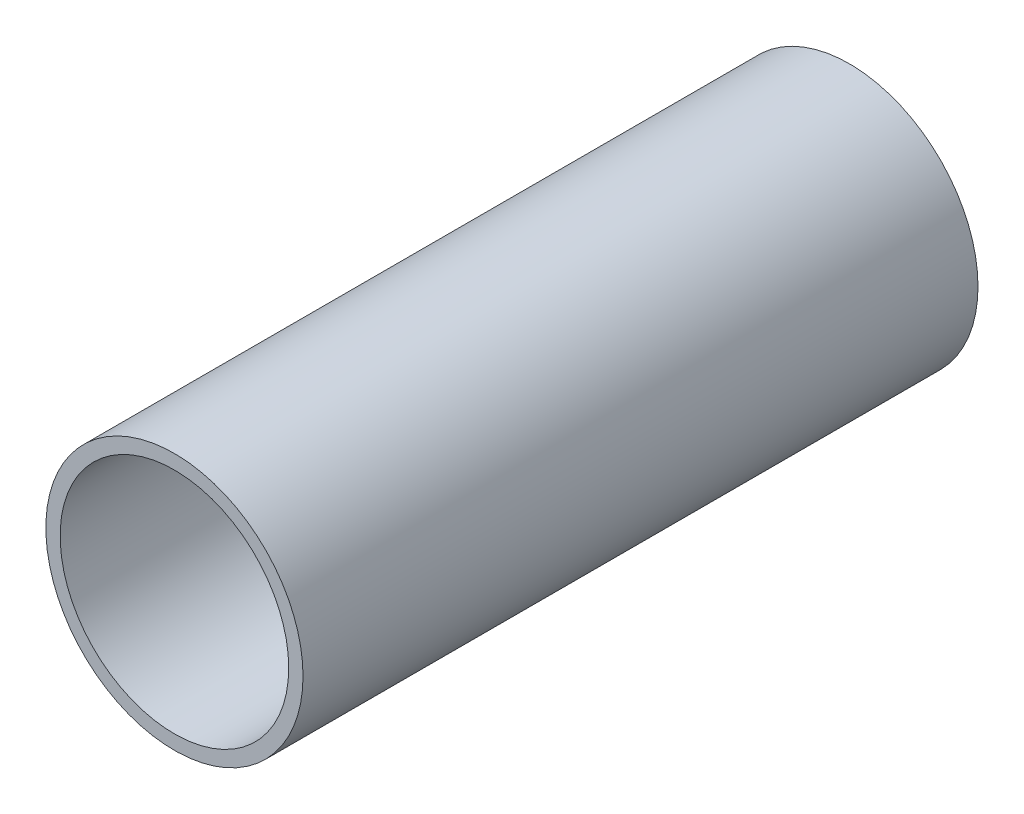
from build123d import *

# Parameters (mm, degrees)
SKETCH_1_R      = 57.15
SKETCH_1_R_2    = 50.8
EXTRUDE_1_DEPTH = 300


with BuildPart() as part:
    # ｽｹｯﾁ1 → ﾎﾞｽ - 押し出し1 (new body)
    with BuildSketch(Plane.XY):
        Circle(SKETCH_1_R)
        Circle(SKETCH_1_R_2, mode=Mode.SUBTRACT)
    extrude(amount=EXTRUDE_1_DEPTH)


solid = part.part
